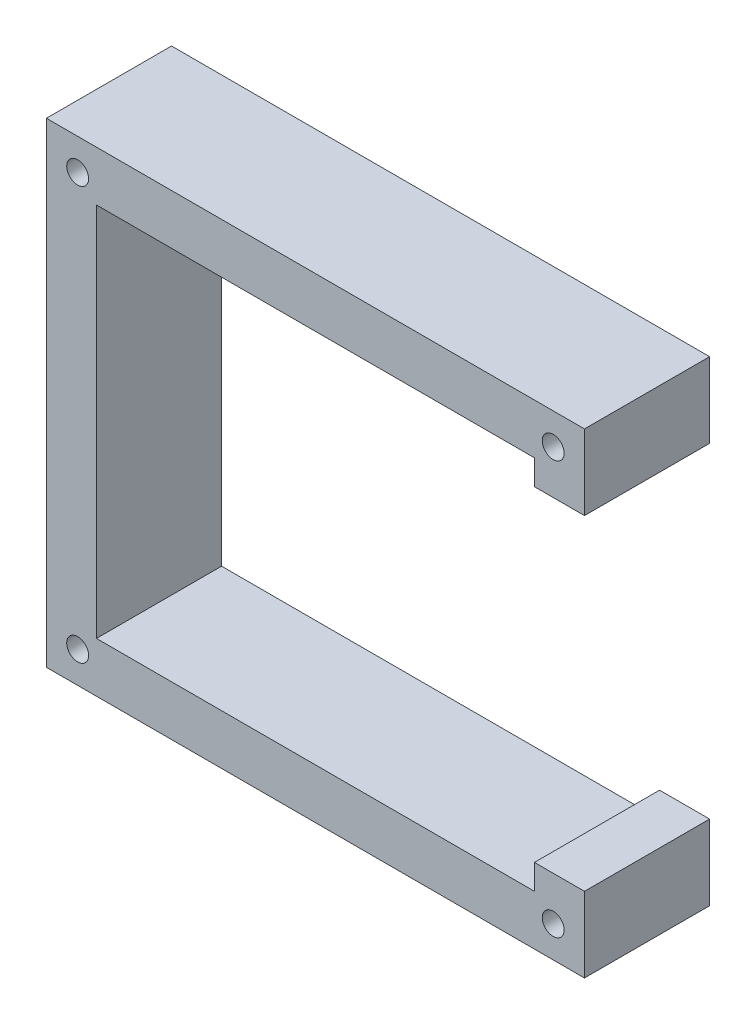
from build123d import *

# Parameters (mm, degrees)
SKETCH_1_W          = 86
SKETCH_1_H          = 76
SKETCH_1_R          = 1.75
SKETCH_1_W_2        = 70
SKETCH_1_H_2        = 60
EXTRUDE_1_DEPTH     = 20
CUT_EXTRUDE_1_REACH = 62.77
SKETCH_2_W          = 8
SKETCH_2_H          = 52


with BuildPart() as part:
    # 草图1 → 凸台-拉伸1 (new body)
    with BuildSketch(Plane.XY):
        Rectangle(SKETCH_1_W, SKETCH_1_H)
        with Locations((-38, 33)):
            Circle(SKETCH_1_R, mode=Mode.SUBTRACT)
        with Locations((38, 33)):
            Circle(SKETCH_1_R, mode=Mode.SUBTRACT)
        with Locations((38, -33)):
            Circle(SKETCH_1_R, mode=Mode.SUBTRACT)
        with Locations((-38, -33)):
            Circle(SKETCH_1_R, mode=Mode.SUBTRACT)
        Rectangle(SKETCH_1_W_2, SKETCH_1_H_2, mode=Mode.SUBTRACT)
    extrude(amount=EXTRUDE_1_DEPTH)

    # 草图2 → 切除-拉伸1 (cut, up to next)
    with BuildSketch(Plane(origin=(0, 0, 0), x_dir=(-1, 0, 0), z_dir=(0, 0, -1)), mode=Mode.PRIVATE) as cut_extrude_1_sk1:
        with Locations((-39, 0)):
            Rectangle(SKETCH_2_W, SKETCH_2_H)
    cut_extrude_1_tool1 = extrude(cut_extrude_1_sk1.sketch, amount=-CUT_EXTRUDE_1_REACH, mode=Mode.PRIVATE) & part.part
    add(cut_extrude_1_tool1.solids().sort_by_distance((39, 0, 0))[0], mode=Mode.SUBTRACT)


solid = part.part
